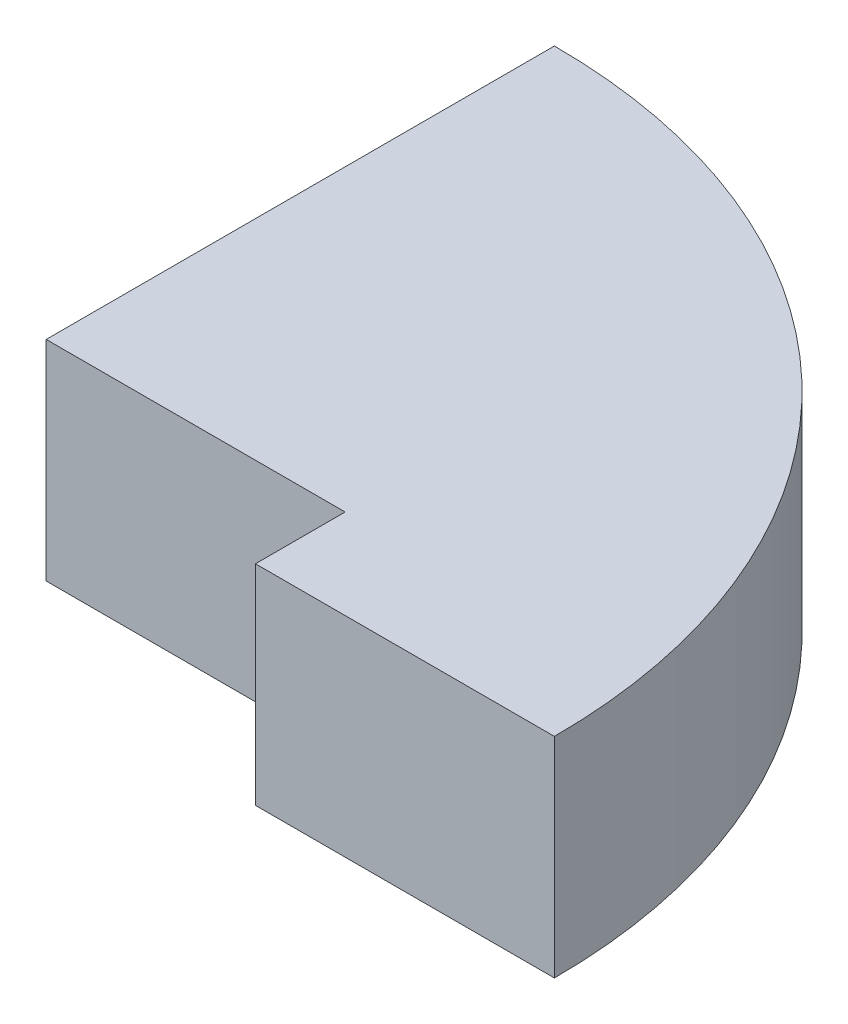
from build123d import *

# Parameters (mm, degrees)
BOSS_EXTRUDE1_DEPTH = 22.225


with BuildPart() as part:
    # Sketch1 → Boss-Extrude1 (new body)
    with BuildSketch(Plane(origin=(0, 0, 0), x_dir=(1, 0, 0), z_dir=(0, 1, 0))):
        with BuildLine():
            Line((0, 63.5), (0, 9.525))
            Line((0, 9.525), (31.75, 9.525))
            Line((31.75, 9.525), (31.75, 0))
            Line((31.75, 0), (63.5, 0))
            ThreePointArc((63.5, 0), (44.901280605, 44.901280605), (0, 63.5))
        make_face()
    extrude(amount=BOSS_EXTRUDE1_DEPTH)


solid = part.part
